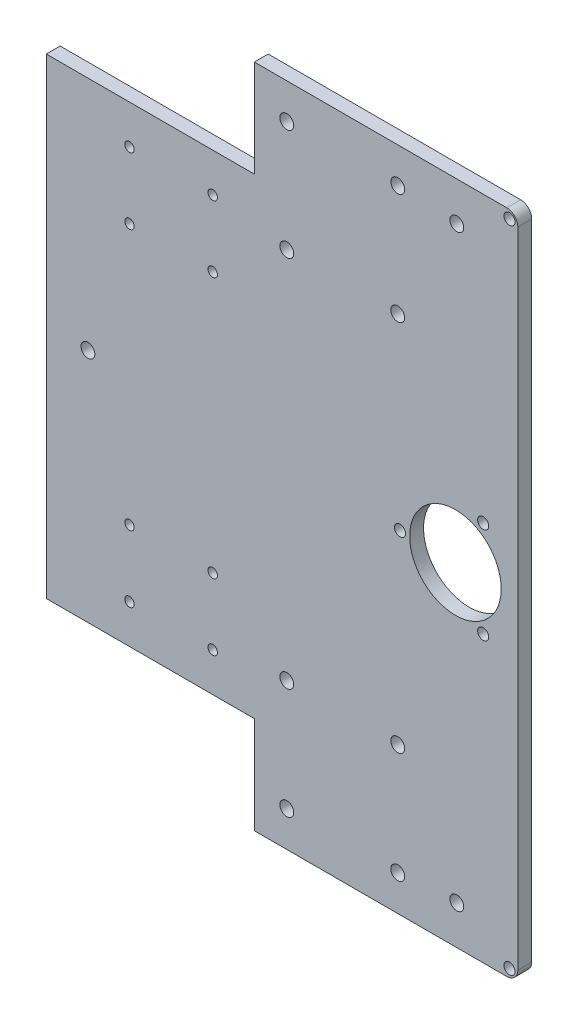
from build123d import *

# Parameters (mm, degrees)
SKETCH1_W           = 170
SKETCH1_H           = 240
BOSS_EXTRUDE1_DEPTH = 5
SKETCH2_R           = 16.5
CUT_EXTRUDE1_DEPTH  = 148.139389696
SKETCH3_R           = 2
CUT_EXTRUDE2_DEPTH  = 148.139389696
SKETCH4_R           = 1.7
CUT_EXTRUDE3_DEPTH  = 148.139389696
SKETCH5_W           = 75
SKETCH5_H           = 35
CUT_EXTRUDE4_DEPTH  = 148.139389696
FILLET1_R           = 4
SKETCH6_R           = 2
CUT_EXTRUDE5_DEPTH  = 148.139389696
FILLET2_R           = 4
SKETCH7_R           = 2.5
CUT_EXTRUDE6_DEPTH  = 148.139389696
SKETCH8_R           = 2.5
CUT_EXTRUDE7_DEPTH  = 148.139389696


with BuildPart() as part:
    # Sketch1 → Boss-Extrude1 (new body)
    with BuildSketch(Plane.XY):
        Rectangle(SKETCH1_W, SKETCH1_H)
    extrude(amount=BOSS_EXTRUDE1_DEPTH)

    # Sketch2 → Cut-Extrude1 (cut, through all)
    with BuildSketch(Plane.XY.offset(5)):
        with Locations((62.5, 0)):
            Circle(SKETCH2_R)
    extrude(amount=-CUT_EXTRUDE1_DEPTH, mode=Mode.SUBTRACT)

    # Sketch3 → Cut-Extrude2 (cut, through all)
    with BuildSketch(Plane.XY.offset(5)):
        with Locations((72.5, -17.320508076)):
            Circle(SKETCH3_R)
        with Locations((72.5, 17.320508076)):
            Circle(SKETCH3_R)
        with Locations((42.5, 0)):
            Circle(SKETCH3_R)
    extrude(amount=-CUT_EXTRUDE2_DEPTH, mode=Mode.SUBTRACT)

    # Sketch4 → Cut-Extrude3 (cut, through all)
    with BuildSketch(Plane.XY.offset(5)):
        with Locations((-25, 47)):
            Circle(SKETCH4_R)
        with Locations((-25, 71)):
            Circle(SKETCH4_R)
        with Locations((-55, 47)):
            Circle(SKETCH4_R)
        with Locations((-55, 71)):
            Circle(SKETCH4_R)
        with Locations(Location((-55, -71, 0), (0, 0, 180))):
            Circle(SKETCH4_R)
        with Locations(Location((-25, -71, 0), (0, 0, 180))):
            Circle(SKETCH4_R)
        with Locations(Location((-55, -47, 0), (0, 0, 180))):
            Circle(SKETCH4_R)
        with Locations(Location((-25, -47, 0), (0, 0, 180))):
            Circle(SKETCH4_R)
    extrude(amount=-CUT_EXTRUDE3_DEPTH, mode=Mode.SUBTRACT)

    # Sketch5 → Cut-Extrude4 (cut, through all)
    with BuildSketch(Plane.XY.offset(5)):
        with Locations((-47.5, 102.5)):
            Rectangle(SKETCH5_W, SKETCH5_H)
        with Locations((-47.5, -102.5)):
            Rectangle(SKETCH5_W, SKETCH5_H)
    extrude(amount=-CUT_EXTRUDE4_DEPTH, mode=Mode.SUBTRACT)

    # Fillet1
    fillet1_edges = [part.edges().sort_by_distance(p)[0] for p in [
        (85, -120, 2.5),
    ]]
    fillet(fillet1_edges, radius=FILLET1_R)

    # Sketch6 → Cut-Extrude5 (cut, through all)
    with BuildSketch(Plane.XY.offset(5)):
        with Locations((82, -117)):
            Circle(SKETCH6_R)
    cut_extrude5 = extrude(amount=-CUT_EXTRUDE5_DEPTH, mode=Mode.SUBTRACT)

    # Mirror5: Cut-Extrude5 across plane
    add(cut_extrude5.mirror(Plane.ZX), mode=Mode.SUBTRACT)

    # Fillet2
    fillet2_edges = [part.edges().sort_by_distance(p)[0] for p in [
        (85, 120, 2.5),
    ]]
    fillet(fillet2_edges, radius=FILLET2_R)

    # Sketch7 → Cut-Extrude6 (cut, through all)
    with BuildSketch(Plane.XY.offset(5)):
        with Locations((41.7, 107.25)):
            Circle(SKETCH7_R)
        with Locations((41.7, 67.25)):
            Circle(SKETCH7_R)
        with Locations((1.7, 67.25)):
            Circle(SKETCH7_R)
        with Locations((1.7, 107.25)):
            Circle(SKETCH7_R)
        with Locations((41.7, -107.25)):
            Circle(SKETCH7_R)
        with Locations((1.7, -107.25)):
            Circle(SKETCH7_R)
        with Locations((1.7, -67.25)):
            Circle(SKETCH7_R)
        with Locations((41.7, -67.25)):
            Circle(SKETCH7_R)
    extrude(amount=-CUT_EXTRUDE6_DEPTH, mode=Mode.SUBTRACT)

    # Sketch8 → Cut-Extrude7 (cut, through all)
    with BuildSketch(Plane(origin=(0, 0, 0), x_dir=(-1, 0, 0), z_dir=(0, 0, -1))):
        with Locations((-63, 106)):
            Circle(SKETCH8_R)
        with Locations((-63, -106)):
            Circle(SKETCH8_R)
        with Locations((70, 0)):
            Circle(SKETCH8_R)
    extrude(amount=-CUT_EXTRUDE7_DEPTH, mode=Mode.SUBTRACT)


solid = part.part
